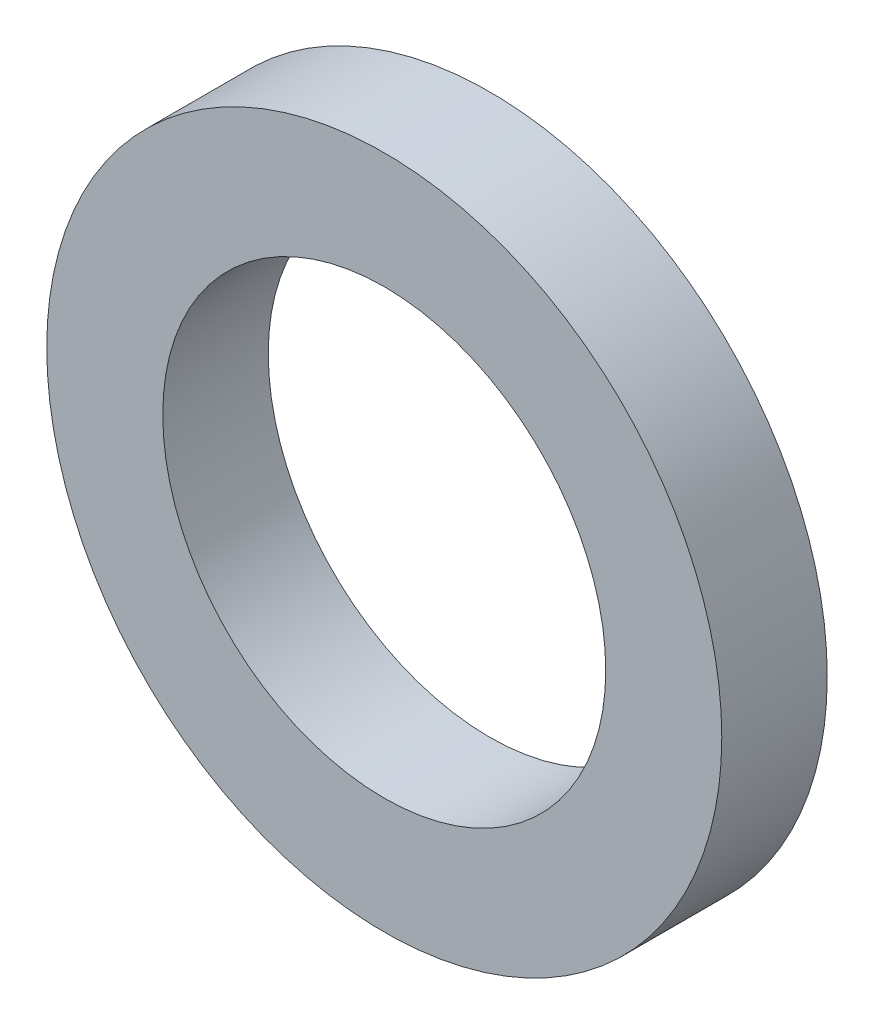
from build123d import *

# Parameters (mm, degrees)
SKETCH_1_R      = 3.2
SKETCH_1_R_2    = 2.1
EXTRUDE_1_DEPTH = 1


with BuildPart() as part:
    # 草圖1 → 填料-伸長1 (new body)
    with BuildSketch(Plane.XY):
        Circle(SKETCH_1_R)
        Circle(SKETCH_1_R_2, mode=Mode.SUBTRACT)
    extrude(amount=EXTRUDE_1_DEPTH)


solid = part.part
